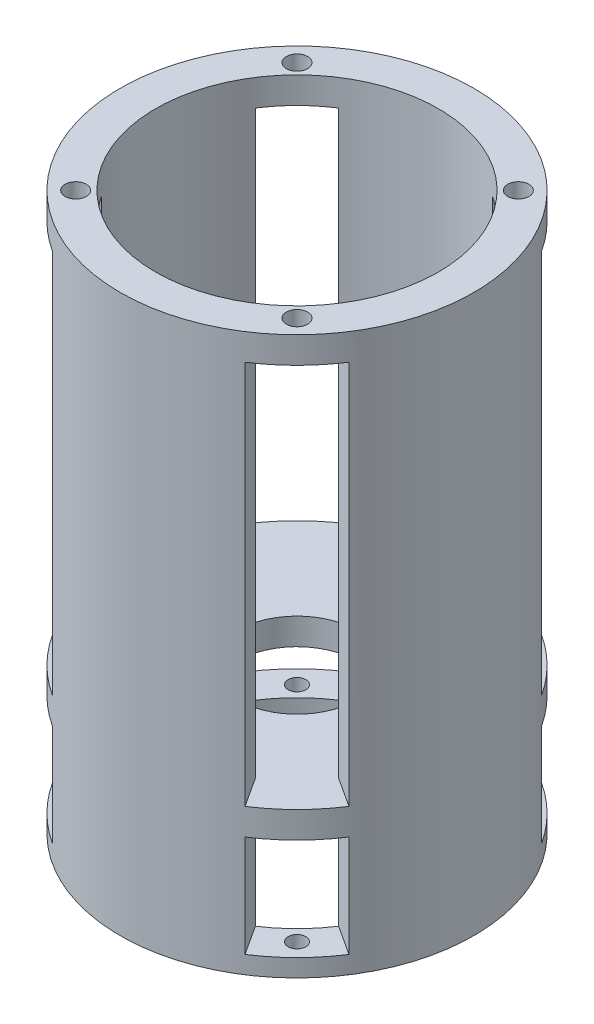
from build123d import *
from build123d.topology import SkipClean

# Parameters (mm, degrees)
IZIM1_R                     = 100
IZIM1_R_2                   = 80
IZIM1_R_3                   = 6
Y_KSEKLIK_EKSTR_ZYON1_DEPTH = 7.5
Y_KSEKLIK_EKSTR_ZYON2_DEPTH = 300
Y_KSEKLIK_EKSTR_ZYON3_START = -10
IZIM3_R                     = 100
IZIM3_R_2                   = 80
Y_KSEKLIK_EKSTR_ZYON3_DEPTH = 10
IZIM4_R                     = 5
KES_EKSTR_ZYON1_DEPTH       = 29
IZIM5_R                     = 100
IZIM5_R_2                   = 34
Y_KSEKLIK_EKSTR_ZYON4_DEPTH = 7.5


with BuildPart() as part:
    # Çizim1 → Yükseklik-Ekstrüzyon1 (new, symmetric)
    with BuildSketch(Plane(origin=(0, 0, 0), x_dir=(1, 0, 0), z_dir=(0, 1, 0))):
        Circle(IZIM1_R)
        Circle(IZIM1_R_2, mode=Mode.SUBTRACT)
        with Locations((62.578950135, 62.578950135)):
            Circle(IZIM1_R_3, mode=Mode.SUBTRACT)
        with Locations((62.578950135, -62.578950135)):
            Circle(IZIM1_R_3, mode=Mode.SUBTRACT)
        with Locations((-62.578950135, -62.578950135)):
            Circle(IZIM1_R_3, mode=Mode.SUBTRACT)
        with Locations((-62.578950135, 62.578950135)):
            Circle(IZIM1_R_3, mode=Mode.SUBTRACT)
    extrude(amount=Y_KSEKLIK_EKSTR_ZYON1_DEPTH, both=True)

    # Çizim2 → Yükseklik-Ekstrüzyon2 (add)
    with SkipClean():  # the faces are left unmerged after this step: merging them gives an invalid solid
        with BuildSketch(Plane.XZ.offset(7.5)):
            with BuildLine():
                Line((-43.571122801, 67.093645436), (-54.463903502, 83.867056795))
                ThreePointArc((-54.463903502, 83.867056795), (0, 100), (54.463903502, 83.867056795))
                Line((54.463903502, 83.867056795), (43.571122801, 67.093645436))
                ThreePointArc((43.571122801, 67.093645436), (0, 80), (-43.571122801, 67.093645436))
            make_face()
            with BuildLine():
                Line((43.571122801, -67.093645436), (54.463903502, -83.867056795))
                ThreePointArc((54.463903502, -83.867056795), (0, -100), (-54.463903502, -83.867056795))
                Line((-54.463903502, -83.867056795), (-43.571122801, -67.093645436))
                ThreePointArc((-43.571122801, -67.093645436), (0, -80), (43.571122801, -67.093645436))
            make_face()
            with BuildLine():
                Line((-67.093645436, 43.571122801), (-83.867056795, 54.463903502))
                ThreePointArc((-83.867056795, 54.463903502), (-100, 0), (-83.867056795, -54.463903502))
                Line((-83.867056795, -54.463903502), (-67.093645436, -43.571122801))
                ThreePointArc((-67.093645436, -43.571122801), (-80, 0), (-67.093645436, 43.571122801))
            make_face()
            with BuildLine():
                Line((67.093645436, -43.571122801), (83.867056795, -54.463903502))
                ThreePointArc((83.867056795, -54.463903502), (100, 0), (83.867056795, 54.463903502))
                Line((83.867056795, 54.463903502), (67.093645436, 43.571122801))
                ThreePointArc((67.093645436, 43.571122801), (80, 0), (67.093645436, -43.571122801))
            make_face()
        extrude(amount=Y_KSEKLIK_EKSTR_ZYON2_DEPTH)

    # Çizim3 → Yükseklik-Ekstrüzyon3 (add)
    with SkipClean():  # the faces are left unmerged after this step: merging them gives an invalid solid
        with BuildSketch(Plane.XZ.offset(307.5).offset(Y_KSEKLIK_EKSTR_ZYON3_START)):
            Circle(IZIM3_R)
            Circle(IZIM3_R_2, mode=Mode.SUBTRACT)
        extrude(amount=Y_KSEKLIK_EKSTR_ZYON3_DEPTH)

    # Çizim4 → Kes-Ekstrüzyon1 (cut)
    with SkipClean():  # the faces are left unmerged after this step: merging them gives an invalid solid
        with BuildSketch(Plane.XZ.offset(307.5)):
            with Locations((62.932503526, -62.932503526)):
                Circle(IZIM4_R)
            with Locations((-62.932503526, -62.932503526)):
                Circle(IZIM4_R)
            with Locations((-62.932503526, 62.932503526)):
                Circle(IZIM4_R)
            with Locations((62.932503526, 62.932503526)):
                Circle(IZIM4_R)
        extrude(amount=-KES_EKSTR_ZYON1_DEPTH, mode=Mode.SUBTRACT)

    # Çizim5 → Yükseklik-Ekstrüzyon4 (add, symmetric)
    with SkipClean():  # the faces are left unmerged after this step: merging them gives an invalid solid
        with BuildSketch(Plane(origin=(0, -232.5, 0), x_dir=(1, 0, 0), z_dir=(0, 1, 0))):
            Circle(IZIM5_R)
            Circle(IZIM5_R_2, mode=Mode.SUBTRACT)
        extrude(amount=Y_KSEKLIK_EKSTR_ZYON4_DEPTH, both=True)


solid = part.part
